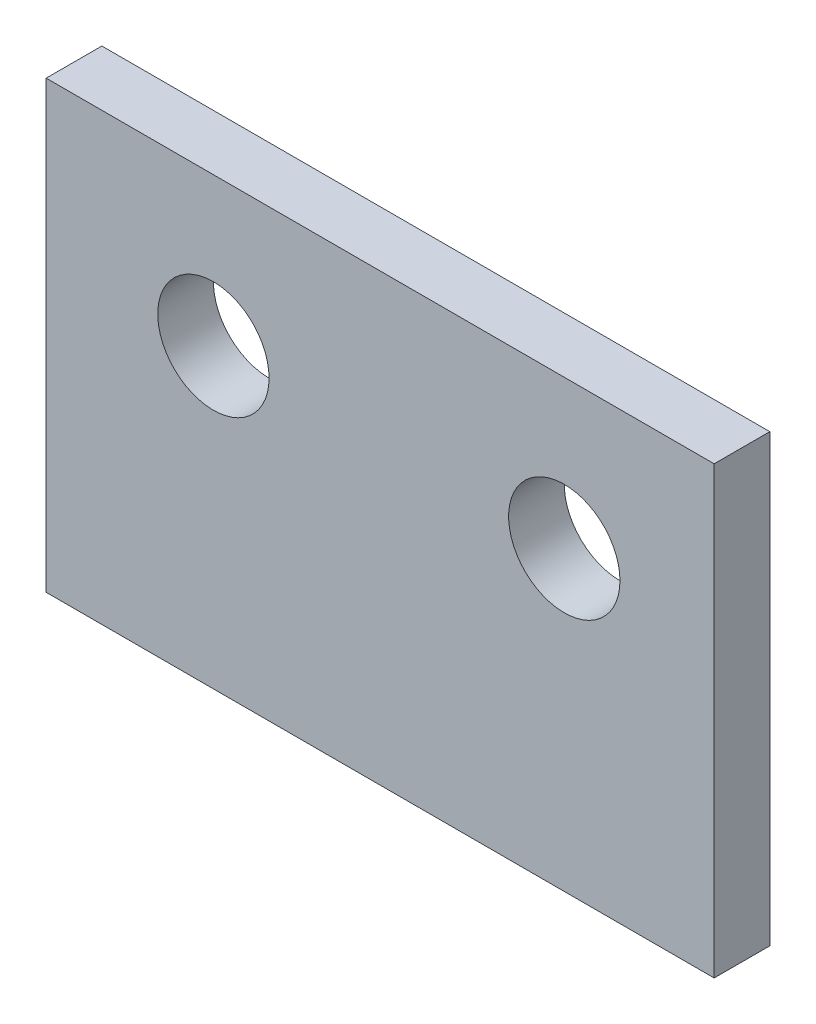
from build123d import *

# Parameters (mm, degrees)
SKETCH1_W           = 60
SKETCH1_H           = 40
SKETCH1_R           = 5
BOSS_EXTRUDE1_DEPTH = 5


with BuildPart() as part:
    # Sketch1 → Boss-Extrude1 (new body)
    with BuildSketch(Plane.XY):
        with Locations((30, 20)):
            Rectangle(SKETCH1_W, SKETCH1_H)
        with Locations((15.020519836, 26.675786594)):
            Circle(SKETCH1_R, mode=Mode.SUBTRACT)
        with Locations((46.538987688, 26.675786594)):
            Circle(SKETCH1_R, mode=Mode.SUBTRACT)
    extrude(amount=BOSS_EXTRUDE1_DEPTH)


solid = part.part
